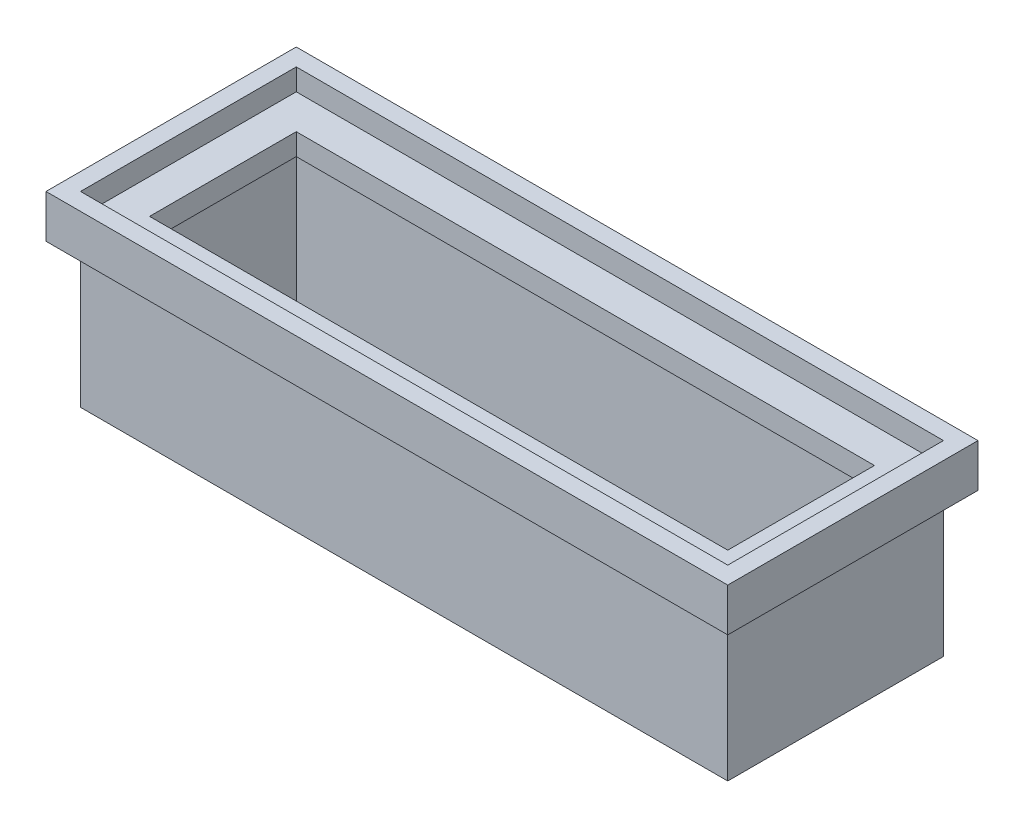
from build123d import *

# Parameters (mm, degrees)
SKETCH2_W           = 45
SKETCH2_H           = 15
SKETCH2_W_2         = 42.6
SKETCH2_H_2         = 12.6
EXTRUDE_THIN1_DEPTH = 10
SKETCH5_W           = 47.4
SKETCH5_H           = 17.4
SKETCH5_W_2         = 40.2
SKETCH5_H_2         = 10.2
EXTRUDE_THIN3_DEPTH = 3
SKETCH6_W           = 45
SKETCH6_H           = 15
CUT_EXTRUDE2_DEPTH  = 1.5


with BuildPart() as part:
    # Sketch2 → Extrude-Thin1 (new body)
    with BuildSketch(Plane(origin=(0, 0, 0), x_dir=(1, 0, 0), z_dir=(0, 1, 0))):
        with Locations((-5.576315789, 2.647368421)):
            Rectangle(SKETCH2_W, SKETCH2_H)
        with Locations((-5.576315789, 2.647368421)):
            Rectangle(SKETCH2_W_2, SKETCH2_H_2, mode=Mode.SUBTRACT)
    extrude(amount=EXTRUDE_THIN1_DEPTH)

    # Sketch5 → Extrude-Thin3 (add)
    with BuildSketch(Plane(origin=(0, 10, 0), x_dir=(1, 0, 0), z_dir=(0, 1, 0))):
        with Locations((-5.576315789, 2.647368421)):
            Rectangle(SKETCH5_W, SKETCH5_H)
        with Locations((-5.576315789, 2.647368421)):
            Rectangle(SKETCH5_W_2, SKETCH5_H_2, mode=Mode.SUBTRACT)
    extrude(amount=EXTRUDE_THIN3_DEPTH)

    # Sketch6 → Cut-Extrude2 (cut)
    with BuildSketch(Plane(origin=(0, 13, 0), x_dir=(1, 0, 0), z_dir=(0, 1, 0))):
        with Locations((-5.576315789, 2.647368421)):
            Rectangle(SKETCH6_W, SKETCH6_H)
    extrude(amount=-CUT_EXTRUDE2_DEPTH, mode=Mode.SUBTRACT)


solid = part.part
